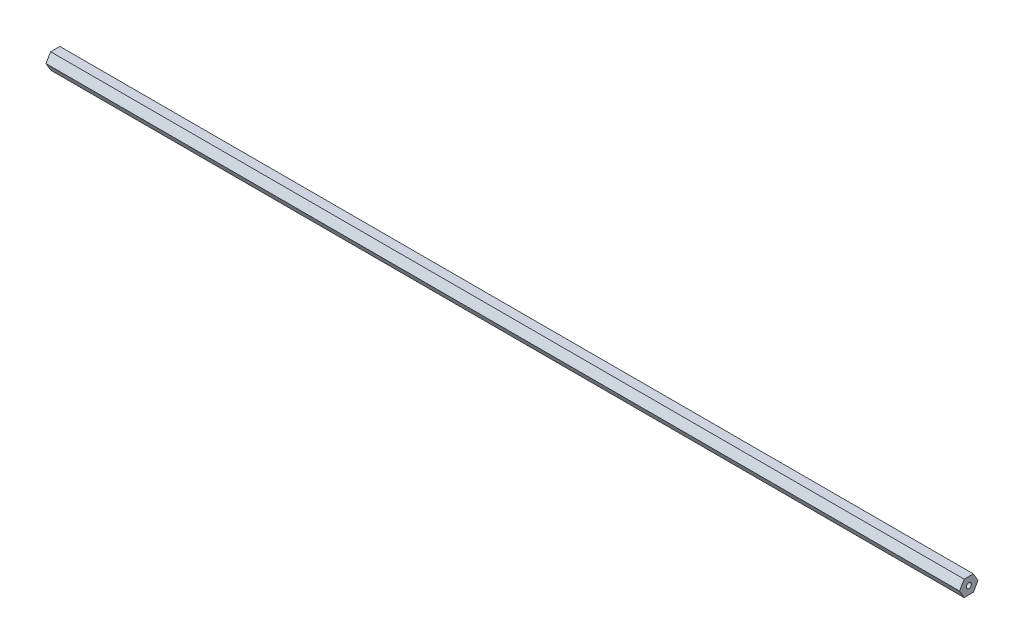
from build123d import *

# Parameters (mm, degrees)
SKETCH1_R           = 2.0193
BOSS_EXTRUDE1_DEPTH = 363.5375


with BuildPart() as part:
    # Sketch1 → Boss-Extrude1 (new, symmetric)
    with BuildSketch(Plane(origin=(0, 0, 0), x_dir=(0, 0, -1), z_dir=(1, 0, 0))):
        Polygon((7.332348419, 0), (3.666174209, 6.35), (-3.666174209, 6.35), (-7.332348419, 0), (-3.666174209, -6.35), (3.666174209, -6.35), align=None)
        Circle(SKETCH1_R, mode=Mode.SUBTRACT)
    extrude(amount=BOSS_EXTRUDE1_DEPTH, both=True)


solid = part.part
